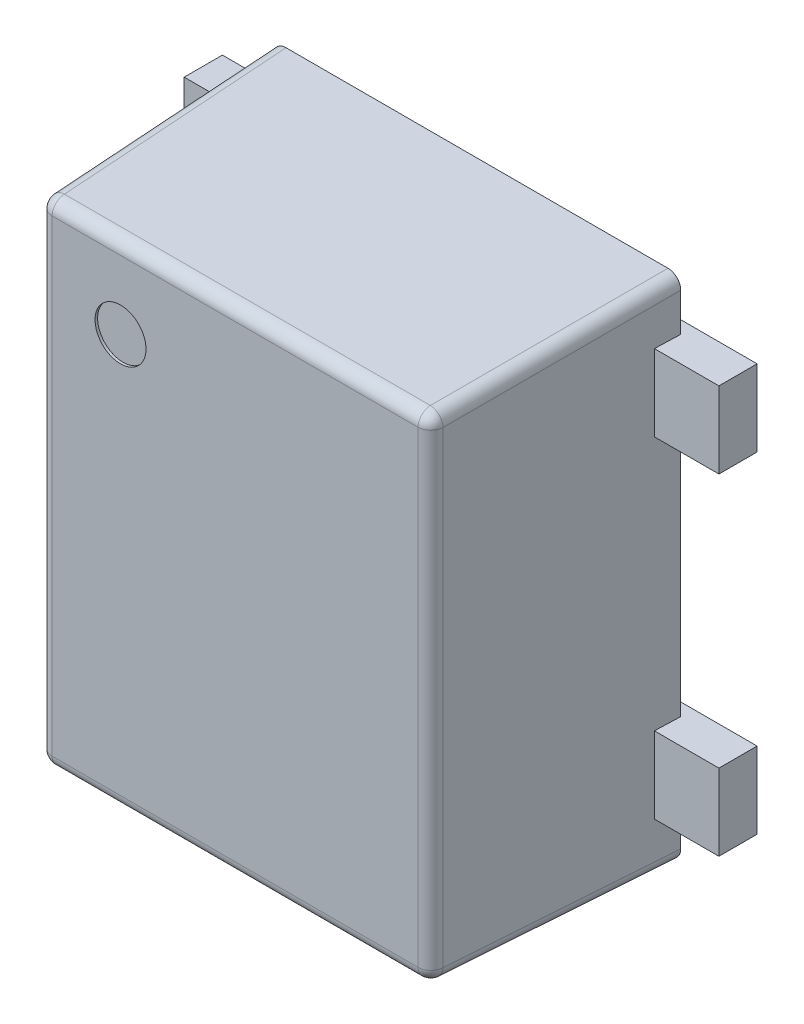
from build123d import *

# Parameters (mm, degrees)
SKETCH_1_W          = 1.6
SKETCH_1_H          = 2
EXTRUDE_1_DEPTH     = 0.95
EXTRUDE_1_TAPER     = 2
SKETCH_2_W          = 0.4
SKETCH_2_H          = 0.3
EXTRUDE_2_DEPTH     = 0.15
FILLET_1_R          = 0.05
SKETCH_3_R          = 0.1
CUT_EXTRUDE_1_DEPTH = 0.01


with BuildPart() as part:
    # Эскиз1 → Бобышка-Вытянуть1 (new body)
    with BuildSketch(Plane.XY.offset(0.05)):
        Rectangle(SKETCH_1_W, SKETCH_1_H)
    extrude(amount=EXTRUDE_1_DEPTH, taper=EXTRUDE_1_TAPER)

    # Эскиз2 → Бобышка-Вытянуть2 (add)
    with BuildSketch(Plane.XY):
        with Locations((0.85, 0.65)):
            Rectangle(SKETCH_2_W, SKETCH_2_H)
        with Locations((0.85, -0.65)):
            Rectangle(SKETCH_2_W, SKETCH_2_H)
        with Locations((-0.85, 0.65)):
            Rectangle(SKETCH_2_W, SKETCH_2_H)
        with Locations((-0.85, -0.65)):
            Rectangle(SKETCH_2_W, SKETCH_2_H)
    extrude(amount=EXTRUDE_2_DEPTH)

    # Скругление1
    fillet_1_edges = [part.edges().sort_by_distance(p)[0] for p in [
        (0.783412634, 0.983412634, 0.525),
        (-0.783412173, 0.983412173, 0.525013228),
        (-0.783412634, -0.983412634, 0.525),
        (0, -0.966825269, 1),
        (0.766825269, 0, 1),
        (0, 0.966825269, 1),
        (-0.766825269, 0, 1),
        (0.783412634, -0.983412634, 0.525),
    ]]
    fillet(fillet_1_edges, radius=FILLET_1_R)

    # Эскиз3 → Вырез-Вытянуть1 (cut)
    with BuildSketch(Plane.XY.offset(1)):
        with Locations((-0.45, 0.65)):
            Circle(SKETCH_3_R)
    extrude(amount=-CUT_EXTRUDE_1_DEPTH, mode=Mode.SUBTRACT)


solid = part.part
